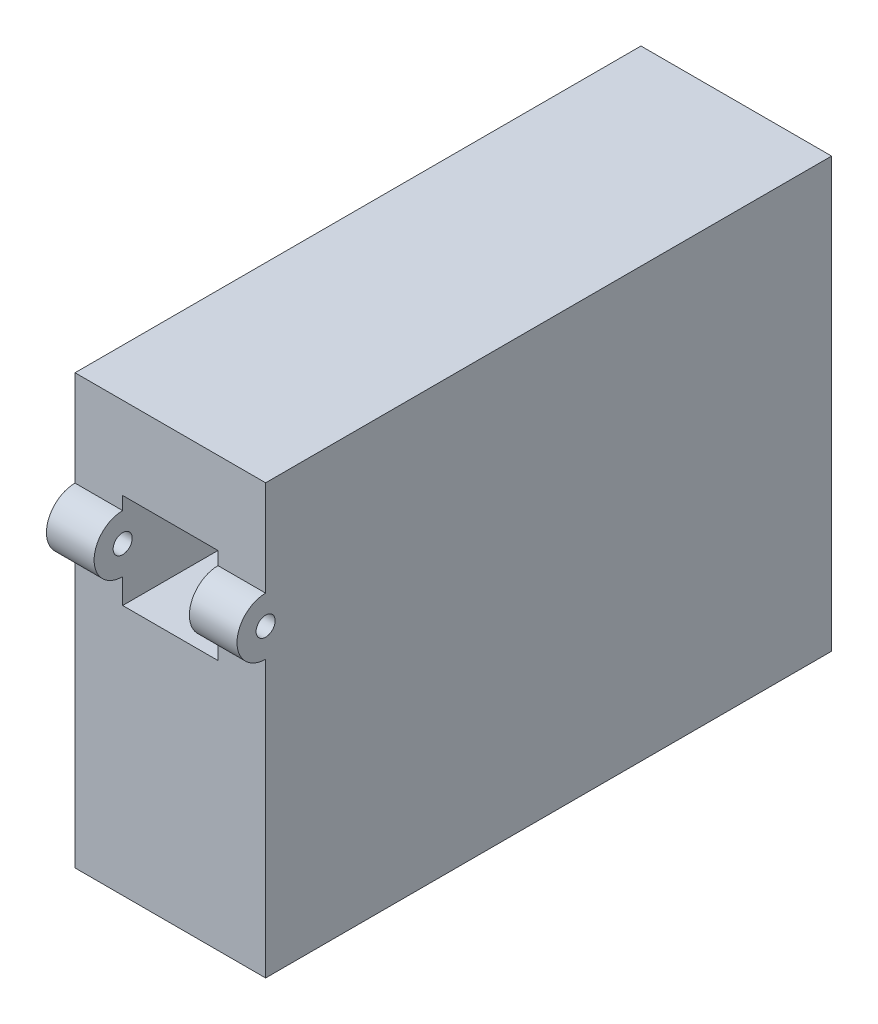
from build123d import *
from build123d.topology import SkipClean

# Parameters (mm, degrees)
BOSS_EXTRUDE2_DEPTH      = 50
BOSS_EXTRUDE2_DEPTH_BACK = 0.0001
SKETCH5_W                = 20
SKETCH5_H                = 59.382936356
SKETCH6_R                = 5
CUT_EXTRUDE1_DEPTH       = 45
SKETCH9_W                = 10
SKETCH9_H                = 10
CUT_EXTRUDE4_DEPTH       = 0.076800532
BOSS_EXTRUDE5_DEPTH      = 5
CUT_EXTRUDE6_DEPTH       = 5
BOSS_EXTRUDE6_START      = -5
BOSS_EXTRUDE6_DEPTH      = 5
SKETCH15_R               = 1
CUT_EXTRUDE7_DEPTH       = 20
SKETCH19_R               = 5
BOSS_EXTRUDE13_DEPTH     = 45
BOSS_EXTRUDE15_DEPTH     = 5
SKETCH22_R               = 1
CUT_EXTRUDE8_DEPTH       = 5
BOSS_EXTRUDE16_START     = -5
BOSS_EXTRUDE16_DEPTH     = 5
SKETCH24_W               = 15.993114704
SKETCH24_H               = 35.984045661
CUT_EXTRUDE9_DEPTH       = 36
SKETCH26_W               = 10
SKETCH26_H               = 10
CUT_EXTRUDE13_DEPTH      = 36
CUT_EXTRUDE14_DEPTH      = 5
SKETCH29_W               = 20.000394844
SKETCH29_H               = 5
CUT_EXTRUDE15_DEPTH      = 1
SKETCH31_R               = 3
CUT_EXTRUDE16_DEPTH      = 3
SKETCH32_W               = 19.994111152
SKETCH32_H               = 5
CUT_EXTRUDE17_DEPTH      = 19
SKETCH33_W               = 19.589439069
SKETCH33_H               = 5
CUT_EXTRUDE18_DEPTH      = 19


with BuildPart() as part:
    # Sketch5 → Boss-Extrude2 (new, two sides: drawn at the far end of the back side and taken through both)
    with BuildSketch(Plane(origin=(0.323578151, 0, -7.846011644), x_dir=(1, 0, 0), z_dir=(0, 1, 0)).offset(-BOSS_EXTRUDE2_DEPTH_BACK)):
        with Locations((-45.061859189, 16.472889188)):
            Rectangle(SKETCH5_W, SKETCH5_H)
    extrude(amount=BOSS_EXTRUDE2_DEPTH + BOSS_EXTRUDE2_DEPTH_BACK)

    # Sketch6 → Cut-Extrude1 (cut)
    with BuildSketch(Plane(origin=(0.323578151, 50, -7.846011644), x_dir=(1, 0, 0), z_dir=(0, 1, 0))):
        with Locations(Location((-45.061859189, 16.574918296, 0), (0, 0, 270))):
            Circle(SKETCH6_R)
    extrude(amount=-CUT_EXTRUDE1_DEPTH, mode=Mode.SUBTRACT)

    # Sketch9 → Cut-Extrude4 (cut)
    with BuildSketch(Plane(origin=(0.323578151, 0, 5.372567346), x_dir=(1, 0, 0), z_dir=(0, 0, 1))):
        with Locations((-45.061859189, 36.348822535)):
            Rectangle(SKETCH9_W, SKETCH9_H)
    extrude(amount=-CUT_EXTRUDE4_DEPTH, mode=Mode.SUBTRACT)

    # Sketch10 → Boss-Extrude5 (add)
    with BuildSketch(Plane(origin=(-34.738281038, 0, -7.846011644), x_dir=(0, 0, -1), z_dir=(1, 0, 0))):
        with BuildLine():
            Line((-13.21857899, 38.972016939), (-13.21857899, 34.972016939))
            ThreePointArc((-13.21857899, 34.972016939), (-15.21857899, 36.972016939), (-13.21857899, 38.972016939))
        make_face()
    extrude(amount=-BOSS_EXTRUDE5_DEPTH)

    # Sketch12 → Cut-Extrude6 (cut)
    with BuildSketch(Plane(origin=(-34.738281038, 0, -7.846011644), x_dir=(0, 0, -1), z_dir=(1, 0, 0))):
        with BuildLine():
            Line((-13.21857899, 37.972016939), (-13.21857899, 35.972016939))
            ThreePointArc((-13.21857899, 35.972016939), (-14.21857899, 36.972016939), (-13.21857899, 37.972016939))
        make_face()
    extrude(amount=-CUT_EXTRUDE6_DEPTH, mode=Mode.SUBTRACT)

    # Sketch14 → Boss-Extrude6 (add)
    with BuildSketch(Plane(origin=(-54.738281038, 0, -7.846011644), x_dir=(0, 0, 1), z_dir=(-1, 0, 0)).offset(BOSS_EXTRUDE6_START)):
        with BuildLine():
            Line((13.21857899, 37.972016939), (13.21857899, 38.972016939))
            ThreePointArc((13.21857899, 38.972016939), (15.21857899, 36.972016939), (13.21857899, 34.972016939))
            Line((13.21857899, 34.972016939), (13.21857899, 35.972016939))
            ThreePointArc((13.21857899, 35.972016939), (14.21857899, 36.972016939), (13.21857899, 37.972016939))
        make_face()
    extrude(amount=BOSS_EXTRUDE6_DEPTH)

    # Sketch15 → Cut-Extrude7 (cut)
    with BuildSketch(Plane(origin=(-34.738281038, 0, -7.846011644), x_dir=(0, 0, -1), z_dir=(1, 0, 0))):
        with Locations((-13.21857899, 36.972016939)):
            Circle(SKETCH15_R)
    extrude(amount=-CUT_EXTRUDE7_DEPTH, mode=Mode.SUBTRACT)

    # Sketch19 → Boss-Extrude13 (add)
    with BuildSketch(Plane(origin=(0.323578151, 50, -7.846011644), x_dir=(1, 0, 0), z_dir=(0, 1, 0))):
        with Locations((-45.061859189, 16.574918296)):
            Circle(SKETCH19_R)
    extrude(amount=-BOSS_EXTRUDE13_DEPTH)

    # Sketch21 → Boss-Extrude15 (add)
    with SkipClean():  # the faces are left unmerged after this step: merging them gives an invalid solid
        with BuildSketch(Plane(origin=(-34.738281038, 0, -7.846011644), x_dir=(0, 0, -1), z_dir=(1, 0, 0))):
            with BuildLine():
                Line((-13.21857899, 39.972016939), (-13.21857899, 37.972016939))
                ThreePointArc((-13.21857899, 37.972016939), (-12.21857899, 36.972016939), (-13.21857899, 35.972016939))
                Line((-13.21857899, 35.972016939), (-13.21857899, 33.972016939))
                ThreePointArc((-13.21857899, 33.972016939), (-16.21857899, 36.972016939), (-13.21857899, 39.972016939))
            make_face()
        extrude(amount=-BOSS_EXTRUDE15_DEPTH)

    # Sketch22 → Cut-Extrude8 (cut)
    with BuildSketch(Plane(origin=(-34.738281038, 0, -7.846011644), x_dir=(0, 0, -1), z_dir=(1, 0, 0))):
        with Locations((-13.21857899, 36.972016939)):
            Circle(SKETCH22_R)
    extrude(amount=-CUT_EXTRUDE8_DEPTH, mode=Mode.SUBTRACT)

    # Sketch23 → Boss-Extrude16 (add)
    with BuildSketch(Plane(origin=(-54.738281038, 0, -7.846011644), x_dir=(0, 0, 1), z_dir=(-1, 0, 0)).offset(BOSS_EXTRUDE16_START)):
        with BuildLine():
            Line((13.21857899, 39.972016939), (13.21857899, 37.972016939))
            ThreePointArc((13.21857899, 37.972016939), (14.21857899, 36.972016939), (13.21857899, 35.972016939))
            Line((13.21857899, 35.972016939), (13.21857899, 33.972016939))
            ThreePointArc((13.21857899, 33.972016939), (16.21857899, 36.972016939), (13.21857899, 39.972016939))
        make_face()
    extrude(amount=BOSS_EXTRUDE16_DEPTH)

    # Sketch24 → Cut-Extrude9 (cut)
    with SkipClean():  # the faces are left unmerged after this step: merging them gives an invalid solid
        with BuildSketch(Plane(origin=(0.323578151, 0, -54.01036901), x_dir=(-1, 0, 0), z_dir=(0, 0, -1))):
            with Locations((45.058416541, 28.00797717)):
                Rectangle(SKETCH24_W, SKETCH24_H)
        extrude(amount=-CUT_EXTRUDE9_DEPTH, mode=Mode.SUBTRACT)

    # Sketch26 → Cut-Extrude13 (cut)
    with SkipClean():  # the faces are left unmerged after this step: merging them gives an invalid solid
        with BuildSketch(Plane(origin=(0.323578151, 0, 5.295766814), x_dir=(1, 0, 0), z_dir=(0, 0, 1))):
            with Locations((-45.061859189, 36.348822535)):
                Rectangle(SKETCH26_W, SKETCH26_H)
        extrude(amount=-CUT_EXTRUDE13_DEPTH, mode=Mode.SUBTRACT)

    # Sketch28 → Cut-Extrude14 (cut)
    with SkipClean():  # the faces are left unmerged after this step: merging them gives an invalid solid
        with BuildSketch(Plane(origin=(0, -0.0001, -2.541953713), x_dir=(-1, 0, 0), z_dir=(0, -1, 0))):
            Polygon((54.738281038, -7.914521059), (34.738281038, -7.914521059), (34.738281038, 31.753302396), (54.738281038, 31.878976227), align=None)
        extrude(amount=-CUT_EXTRUDE14_DEPTH, mode=Mode.SUBTRACT)

    # Sketch29 → Cut-Extrude15 (cut)
    with SkipClean():  # the faces are left unmerged after this step: merging them gives an invalid solid
        with BuildSketch(Plane(origin=(0.1981485, 0, -34.075726363), x_dir=(0.9999802581949765, 0, 0.006283567482586401), z_dir=(-0.006283567482586401, 0, 0.9999802581949766))):
            with Locations((-44.937316682, 2.4999)):
                Rectangle(SKETCH29_W, SKETCH29_H)
        extrude(amount=-CUT_EXTRUDE15_DEPTH, mode=Mode.SUBTRACT)

    # Sketch31 → Cut-Extrude16 (cut)
    with SkipClean():  # the faces are left unmerged after this step: merging them gives an invalid solid
        with BuildSketch(Plane(origin=(0, 4.9999, -2.541953713), x_dir=(-1, 0, 0), z_dir=(0, -1, 0))):
            with Locations(Location((44.738281038, 11.982227584, 0), (0, 0, 90))):
                Circle(SKETCH31_R)
        extrude(amount=-CUT_EXTRUDE16_DEPTH, mode=Mode.SUBTRACT)

    # Sketch32 → Cut-Extrude17 (cut)
    with SkipClean():  # the faces are left unmerged after this step: merging them gives an invalid solid
        with BuildSketch(Plane(origin=(0.22040429, 0, -35.075606257), x_dir=(0.9999802581949765, 0, 0.0062835674825864034), z_dir=(-0.0062835674825864034, 0, 0.9999802581949766))):
            with Locations((-44.956431065, 2.4999)):
                Rectangle(SKETCH32_W, SKETCH32_H)
        extrude(amount=-CUT_EXTRUDE17_DEPTH, mode=Mode.SUBTRACT)

    # Sketch33 → Cut-Extrude18 (cut)
    with SkipClean():  # the faces are left unmerged after this step: merging them gives an invalid solid
        with BuildSketch(Plane.ZY.offset(54.738281038)):
            with Locations((-44.215649476, 2.4999)):
                Rectangle(SKETCH33_W, SKETCH33_H)
        extrude(amount=-CUT_EXTRUDE18_DEPTH, mode=Mode.SUBTRACT)


solid = part.part
